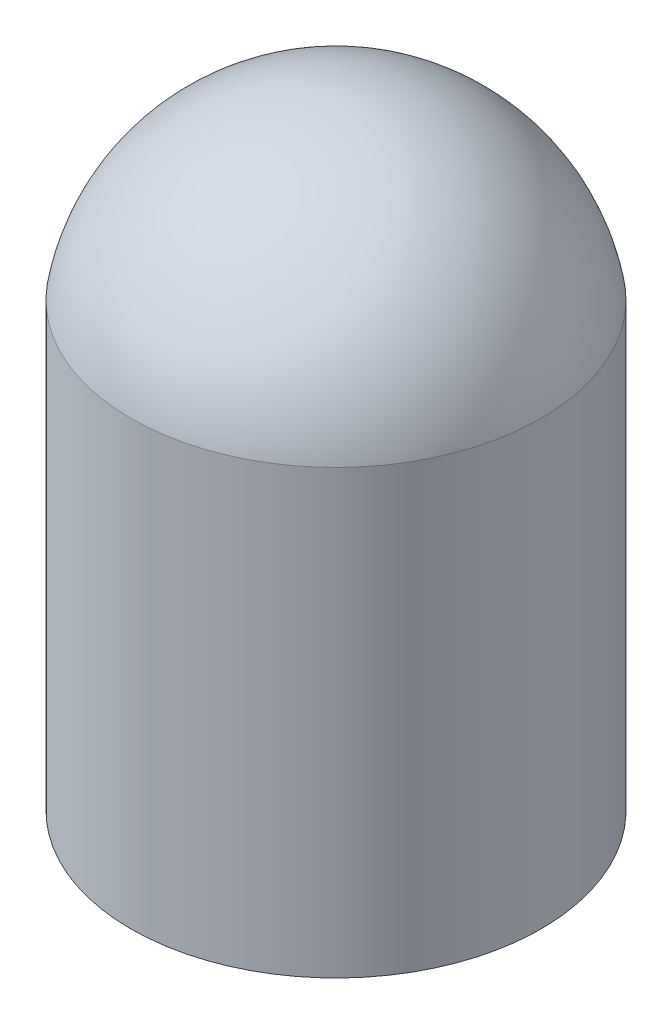
from build123d import *


with BuildPart() as part:
    # Эскиз1 → Повернуть1 (revolve)
    with BuildSketch(Plane(origin=(0, 0, 0), x_dir=(0, 0, -1), z_dir=(1, 0, 0)), mode=Mode.PRIVATE) as revolve_1_sk:
        with BuildLine():
            Line((-88.006897482, -25.615792765), (-88.006897482, -36.395752859))
            Line((-88.006897482, -36.395752859), (-83.007051162, -36.395752859))
            Line((-83.007051162, -36.395752859), (-83.007051162, -21.395752859))
            ThreePointArc((-83.007051162, -21.395752859), (-86.279902989, -22.590017361), (-88.006897482, -25.615792765))
        make_face()
    revolve(revolve_1_sk.sketch.rotate(Axis((0, -36.395752859, 83.007051162), (0, 1, 0)), 180), axis=Axis((0, -36.395752859, 83.007051162), (0, 1, 0)))


solid = part.part
